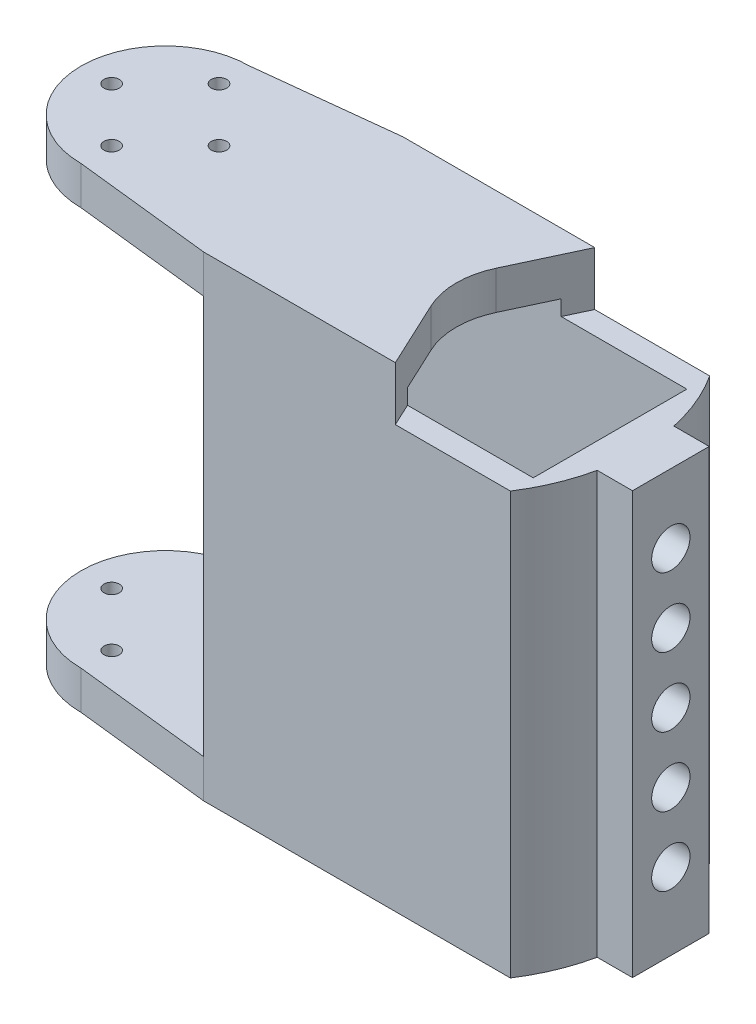
from build123d import *

# Parameters (mm, degrees)
SKETCH1_R           = 11
SKETCH1_R_2         = 1
BOSS_EXTRUDE1_DEPTH = 62
SKETCH2_W           = 69
SKETCH2_H           = 52
CUT_EXTRUDE1_DEPTH  = 10.02
SKETCH4_W           = 22.538678222
SKETCH4_H           = 52
CUT_EXTRUDE2_DEPTH  = 36.02
CUT_EXTRUDE3_START  = -7
CUT_EXTRUDE3_DEPTH  = 7
SKETCH6_R           = 10.02
CUT_EXTRUDE6_DEPTH  = 5
BOSS_EXTRUDE3_START = -13
SKETCH10_W          = 6
SKETCH10_H          = 55
BOSS_EXTRUDE3_DEPTH = 5
SKETCH11_R          = 2.5
CUT_EXTRUDE7_DEPTH  = 5


with BuildPart() as part:
    # Sketch1 → Boss-Extrude1 (new body)
    # profile 1 of 2: a face of its own
    with BuildSketch(Plane(origin=(0, 0, 0), x_dir=(1, 0, 0), z_dir=(0, 1, 0))):
        with BuildLine():
            Line((18, 13), (0, 11))
            ThreePointArc((0, 11), (7.778174593, 7.778174593), (11, 0))
            ThreePointArc((11, 0), (7.778174593, -7.778174593), (0, -11))
            Line((0, -11), (18, -13))
            Line((18, -13), (58, -13))
            ThreePointArc((58, -13), (61.853720884, 0), (58, 13))
            Line((58, 13), (18, 13))
        make_face()
    # profile 2 of 2: a face of its own
    with BuildSketch(Plane(origin=(0, 0, 0), x_dir=(1, 0, 0), z_dir=(0, 1, 0))):
        Circle(SKETCH1_R)
        with Locations(Location((-7, 0, 0), (0, 0, 270))):
            Circle(SKETCH1_R_2, mode=Mode.SUBTRACT)
        with Locations(Location((0, -7, 0), (0, 0, 270))):
            Circle(SKETCH1_R_2, mode=Mode.SUBTRACT)
        with Locations(Location((7, 0, 0), (0, 0, 270))):
            Circle(SKETCH1_R_2, mode=Mode.SUBTRACT)
        with Locations(Location((0, 7, 0), (0, 0, 270))):
            Circle(SKETCH1_R_2, mode=Mode.SUBTRACT)
    extrude(amount=BOSS_EXTRUDE1_DEPTH)

    # Sketch2 → Cut-Extrude1 (cut, symmetric)
    with BuildSketch(Plane.XY):
        with Locations((23.5, 31)):
            Rectangle(SKETCH2_W, SKETCH2_H)
    extrude(amount=CUT_EXTRUDE1_DEPTH, both=True, mode=Mode.SUBTRACT)

    # Sketch4 → Cut-Extrude2 (cut, symmetric)
    with BuildSketch(Plane.XY):
        with Locations((6.730660889, 31)):
            Rectangle(SKETCH4_W, SKETCH4_H)
    extrude(amount=CUT_EXTRUDE2_DEPTH, both=True, mode=Mode.SUBTRACT)

    # Sketch5 → Cut-Extrude3 (cut)
    with BuildSketch(Plane(origin=(0, 62, 0), x_dir=(1, 0, 0), z_dir=(0, 1, 0)).offset(CUT_EXTRUDE3_START)):
        with BuildLine():
            Line((43, -13), (58, -13))
            ThreePointArc((58, -13), (61.853720884, 0), (58, 13))
            Line((58, 13), (43, 13))
            Line((43, 13), (38.904298876, 4.246416031))
            ThreePointArc((38.904298876, 4.246416031), (37.96, 0), (38.904298876, -4.246416031))
            Line((38.904298876, -4.246416031), (43, -13))
        make_face()
    extrude(amount=CUT_EXTRUDE3_DEPTH, mode=Mode.SUBTRACT)

    # Sketch6 → Cut-Extrude6 (cut)
    with BuildSketch(Plane.XZ):
        with Locations(Location((47.98, 0, 0), (0, 0, 270))):
            Circle(SKETCH6_R)
    extrude(amount=-CUT_EXTRUDE6_DEPTH, mode=Mode.SUBTRACT)

    # Sketch10 → Boss-Extrude3 (add, symmetric)
    with BuildSketch(Plane.XY.offset(13).offset(BOSS_EXTRUDE3_START)):
        with Locations((62.926860442, 27.5)):
            Rectangle(SKETCH10_W, SKETCH10_H)
    extrude(amount=BOSS_EXTRUDE3_DEPTH, both=True)

    # Sketch11 → Cut-Extrude7 (cut)
    with BuildSketch(Plane(origin=(65.926860442, 0, 0), x_dir=(0, 0, -1), z_dir=(1, 0, 0))):
        with Locations((0, 46)):
            Circle(SKETCH11_R)
        with Locations((0, 37)):
            Circle(SKETCH11_R)
        with Locations((0, 28)):
            Circle(SKETCH11_R)
        with Locations((0, 19)):
            Circle(SKETCH11_R)
        with Locations((0, 10)):
            Circle(SKETCH11_R)
    extrude(amount=-CUT_EXTRUDE7_DEPTH, mode=Mode.SUBTRACT)


solid = part.part
